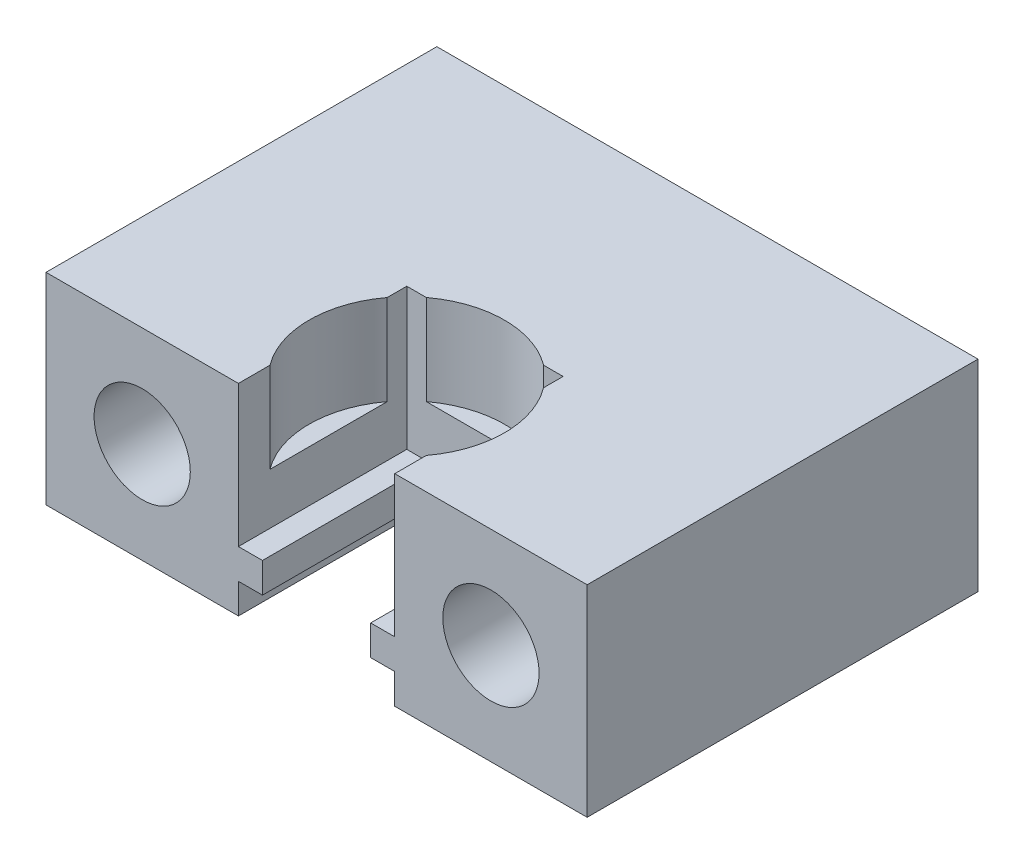
from build123d import *

# Parameters (mm, degrees)
SKETCH1_W           = 18
SKETCH1_H           = 6.7
BOSS_EXTRUDE1_DEPTH = 13
CUT_EXTRUDE1_REACH  = 19.172
SKETCH3_R           = 3.25
CUT_EXTRUDE2_DEPTH  = 3
SKETCH4_W           = 0.8
SKETCH4_H           = 1
BOSS_EXTRUDE2_DEPTH = 5.6
CUT_EXTRUDE3_REACH  = 19.172
SKETCH8_R           = 1.6


with BuildPart() as part:
    # Sketch1 → Boss-Extrude1 (new body)
    with BuildSketch(Plane.XY):
        with Locations((0, 3.35)):
            Rectangle(SKETCH1_W, SKETCH1_H)
    extrude(amount=BOSS_EXTRUDE1_DEPTH)

    # Sketch2 → Cut-Extrude1 (cut, up to next)
    with BuildSketch(Plane.XZ, mode=Mode.PRIVATE) as cut_extrude1_sk1:
        Polygon((-2.6, 12.6), (-2.6, 13), (2.6, 13), (2.6, 12.6), (2.6, 7.4), (-2.6, 7.4), align=None)
    cut_extrude1_tool1 = extrude(cut_extrude1_sk1.sketch, amount=-CUT_EXTRUDE1_REACH, mode=Mode.PRIVATE) & part.part
    add(cut_extrude1_tool1.solids().sort_by_distance((0, 0, 10.2))[0], mode=Mode.SUBTRACT)

    # Sketch3 → Cut-Extrude2 (cut)
    with BuildSketch(Plane(origin=(0, 6.7, 0), x_dir=(1, 0, 0), z_dir=(0, 1, 0))):
        with Locations((0, -10)):
            Circle(SKETCH3_R)
    extrude(amount=-CUT_EXTRUDE2_DEPTH, mode=Mode.SUBTRACT)

    # Sketch4 → Boss-Extrude2 (add)
    with BuildSketch(Plane.XY.offset(13)):
        with Locations((-2.2, 1.5)):
            Rectangle(SKETCH4_W, SKETCH4_H)
        with Locations((2.2, 1.5)):
            Rectangle(SKETCH4_W, SKETCH4_H)
    extrude(amount=-BOSS_EXTRUDE2_DEPTH)

    # Sketch8 → Cut-Extrude3 (cut, up to next)
    with BuildSketch(Plane.XY.offset(13), mode=Mode.PRIVATE) as cut_extrude3_sk1:
        with Locations((-5.8, 3.35)):
            Circle(SKETCH8_R)
    cut_extrude3_tool1 = extrude(cut_extrude3_sk1.sketch, amount=-CUT_EXTRUDE3_REACH, mode=Mode.PRIVATE) & part.part
    cut_extrude3 = cut_extrude3_tool1.solids().sort_by_distance((-5.8, 3.35, 13))[0]
    add(cut_extrude3, mode=Mode.SUBTRACT)

    # Mirror1: Cut-Extrude3 across plane
    add(cut_extrude3.mirror(Plane(origin=(0, 0, 0), x_dir=(0, 0, 1), z_dir=(1, 0, 0))), mode=Mode.SUBTRACT)


solid = part.part
